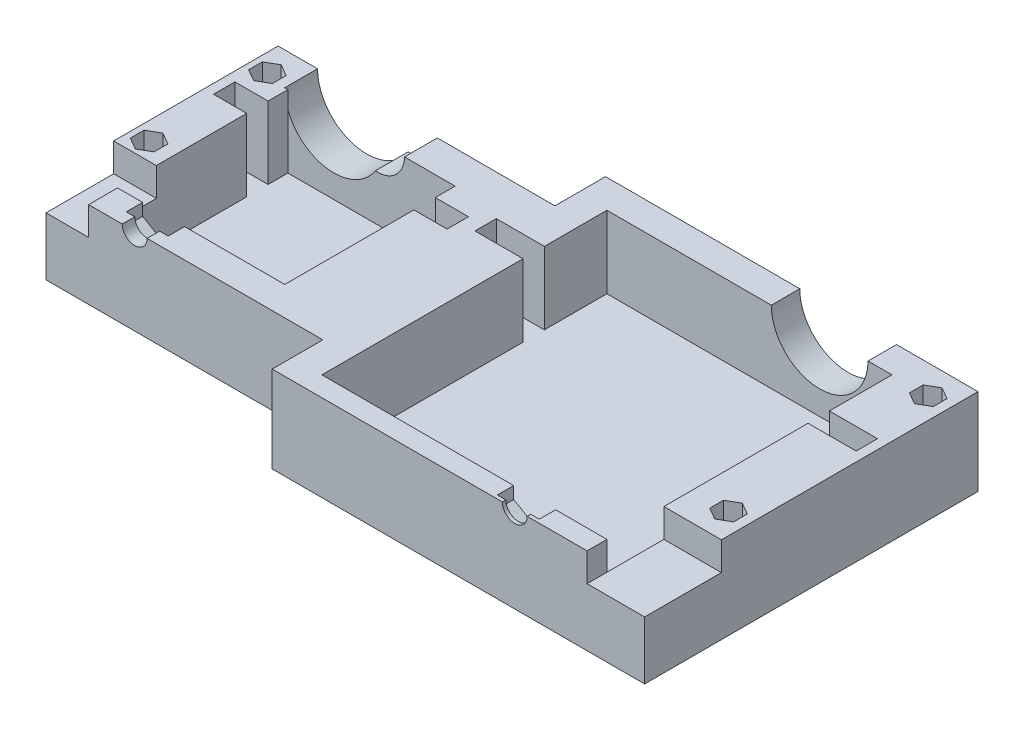
from build123d import *

# Parameters (mm, degrees)
BOSS_EXTRUDE1_DEPTH = 12.1700036
SKETCH2_W           = 8.1000092
SKETCH2_H           = 10.8000038
SKETCH2_W_2         = 6.0000134
SKETCH2_H_2         = 9.5240094
CUT_EXTRUDE1_DEPTH  = 3.999992
CUT_EXTRUDE2_DEPTH  = 10.1700076
CUT_EXTRUDE3_DEPTH  = 4.0060118
CUT_EXTRUDE4_DEPTH  = 4.6199806
CUT_EXTRUDE5_DEPTH  = 5.2500022
CUT_EXTRUDE6_REACH  = 83.189
SKETCH7_R           = 1.7499965
CUT_EXTRUDE7_DEPTH  = 2.2999954
CUT_EXTRUDE8_DEPTH  = 2.2999954
SKETCH10_R          = 1.2499975
CUT_EXTRUDE9_DEPTH  = 71.298530747


with BuildPart() as part:
    # Sketch1 → Boss-Extrude1 (new body)
    with BuildSketch(Plane(origin=(0, 0, 0), x_dir=(1, 0, 0), z_dir=(0, 1, 0))):
        Polygon((-26.1999984, 16.3249991), (-26.1999984, 23.4500039), (26.1999984, 23.4500039), (26.1999984, -23.4500039), (-26.1999984, -23.4500039), (-26.1999984, -16.3249991), (-65.1450056, -16.3249991), (-65.1450056, 16.3249991), align=None)
    extrude(amount=BOSS_EXTRUDE1_DEPTH)

    # Sketch2 → Cut-Extrude1 (cut)
    with BuildSketch(Plane(origin=(0, 12.1700036, 0), x_dir=(1, 0, 0), z_dir=(0, 1, 0))):
        with Locations((22.1499938, -18.050002)):
            Rectangle(SKETCH2_W, SKETCH2_H)
        with Locations((-62.1449989, -11.5629944)):
            Rectangle(SKETCH2_W_2, SKETCH2_H_2)
    extrude(amount=-CUT_EXTRUDE1_DEPTH, mode=Mode.SUBTRACT)

    # Sketch3 → Cut-Extrude2 (cut)
    with BuildSketch(Plane(origin=(0, 12.1700036, 0), x_dir=(1, 0, 0), z_dir=(0, 1, 0))):
        Polygon((-59.1449922, -12.2549793), (-35.6249986, -12.2549793), (-35.6249986, 5.9090179), (-30.9599838, 5.9090179), (-30.9599838, 8.9190195), (-35.6249986, 8.9190195), (-35.6249986, 11.7050185), (-59.1449922, 11.7050185), (-59.1449922, 8.9190195), (-63.810007, 8.9190195), (-63.810007, 5.9090179), (-59.1449922, 5.9090179), align=None)
        Polygon((18.0999892, -20.6560039), (-22.0000068, -20.6560039), (-22.0000068, 7.6439903), (-28.7650174, 7.6439903), (-28.7650174, 10.6439843), (-22.0000068, 10.6439843), (-22.0000068, 19.4439921), (18.0999892, 19.4439921), (18.0999892, 10.6439843), (24.8649998, 10.6439843), (24.8649998, 7.6439903), (18.0999892, 7.6439903), align=None)
    extrude(amount=-CUT_EXTRUDE2_DEPTH, mode=Mode.SUBTRACT)

    # Sketch4 → Cut-Extrude3 (cut)
    with BuildSketch(Plane(origin=(0, 0, -23.4500039), x_dir=(-1, 0, 0), z_dir=(0, 0, -1))):
        with BuildLine():
            Line((-1.1299952, 12.1700036), (-14.7299934, 12.1700036))
            ThreePointArc((-14.7299934, 12.1700036), (-7.9299943, 5.3700045), (-1.1299952, 12.1700036))
        make_face()
    extrude(amount=-CUT_EXTRUDE3_DEPTH, mode=Mode.SUBTRACT)

    # Sketch5 → Cut-Extrude4 (cut)
    with BuildSketch(Plane(origin=(0, 0, -16.3249991), x_dir=(-1, 0, 0), z_dir=(0, 0, -1))):
        with BuildLine():
            ThreePointArc((46.838108, 8.4362036), (54.615256842, 5.524304205), (59.595004, 12.1700036))
            Line((59.595004, 12.1700036), (46.838108, 12.1700036))
            Line((46.838108, 12.1700036), (42.7449996, 12.1700036))
            ThreePointArc((42.7449996, 12.1700036), (43.96774198, 9.400015303), (46.838108, 8.4362036))
        make_face()
    extrude(amount=-CUT_EXTRUDE4_DEPTH, mode=Mode.SUBTRACT)

    # Sketch6 → Cut-Extrude5 (cut)
    with BuildSketch(Plane(origin=(0, 12.1700036, 0), x_dir=(1, 0, 0), z_dir=(0, 1, 0))):
        Polygon((-62.6450106, 14.2591155), (-64.320008607, 13.29205495), (-64.320008607, 11.35793385), (-62.6450106, 10.3908733), (-60.970012593, 11.35793385), (-60.970012593, 13.29205495), align=None)
        Polygon((-62.6450106, -2.3908893), (-64.320008607, -3.35794985), (-64.320008607, -5.29207095), (-62.6450106, -6.2591315), (-60.970012593, -5.29207095), (-60.970012593, -3.35794985), align=None)
        Polygon((23.2000044, 21.3841203), (21.525006393, 20.41705975), (21.525006393, 18.48293865), (23.2000044, 17.5158781), (24.875002407, 18.48293865), (24.875002407, 20.41705975), align=None)
        Polygon((23.2000044, -6.7158743), (21.525006393, -7.68293485), (21.525006393, -9.61705595), (23.2000044, -10.5841165), (24.875002407, -9.61705595), (24.875002407, -7.68293485), align=None)
    extrude(amount=-CUT_EXTRUDE5_DEPTH, mode=Mode.SUBTRACT)

    # Cut-Extrude6: up to this face of the body (flat: up to its plane)
    cut_extrude6_end = Plane(part.part.faces().sort_by_distance((-47.3849954, 7.0849998, 12.2549793))[0])
    # Sketch7 → Cut-Extrude6 (cut, up to the picked face)
    with BuildSketch(Plane.XY.offset(23.4500039), mode=Mode.PRIVATE) as cut_extrude6_sk1:
        with Locations((-52.6700115, 12.1700036)):
            Circle(SKETCH7_R)
    cut_extrude6_tool1 = split(extrude(cut_extrude6_sk1.sketch, amount=-CUT_EXTRUDE6_REACH, mode=Mode.PRIVATE), bisect_by=cut_extrude6_end, keep=Keep.BOTH, mode=Mode.PRIVATE)
    # Sketch7 → Cut-Extrude6 (cut, up to the picked face)
    with BuildSketch(Plane.XY.offset(23.4500039), mode=Mode.PRIVATE) as cut_extrude6_sk2:
        with Locations((7.9299943, 12.1700036)):
            Circle(SKETCH7_R)
    cut_extrude6_tool2 = split(extrude(cut_extrude6_sk2.sketch, amount=-CUT_EXTRUDE6_REACH, mode=Mode.PRIVATE), bisect_by=cut_extrude6_end, keep=Keep.BOTH, mode=Mode.PRIVATE)
    add(cut_extrude6_tool1.solids().sort_by(Axis((-52.670012, 12.170004, 23.450004), (0, 0, -1)))[0], mode=Mode.SUBTRACT)
    add(cut_extrude6_tool2.solids().sort_by(Axis((7.929994, 12.170004, 23.450004), (0, 0, -1)))[0], mode=Mode.SUBTRACT)

    # Sketch8 → Cut-Extrude7 (cut)
    with BuildSketch(Plane(origin=(0, 0, 20.6560039), x_dir=(-1, 0, 0), z_dir=(0, 0, -1))):
        Polygon((-10.8799884, 12.1700036), (-10.8799884, 10.466832), (-7.9299943, 8.763634463), (-4.9800002, 10.466832), (-4.9800002, 12.1700036), align=None)
    extrude(amount=-CUT_EXTRUDE7_DEPTH, mode=Mode.SUBTRACT)

    # Sketch9 → Cut-Extrude8 (cut)
    with BuildSketch(Plane(origin=(0, 0, 12.2549793), x_dir=(-1, 0, 0), z_dir=(0, 0, -1))):
        Polygon((49.7200174, 12.1700036), (49.7200174, 10.466832), (52.6700115, 8.763634463), (55.6200056, 10.466832), (55.6200056, 12.1700036), align=None)
    extrude(amount=-CUT_EXTRUDE8_DEPTH, mode=Mode.SUBTRACT)

    # Sketch10 → Cut-Extrude9 (cut, through all)
    with BuildSketch(Plane(origin=(0, 12.1700036, 0), x_dir=(1, 0, 0), z_dir=(0, 1, 0))):
        with Locations(Location((-62.6450106, 12.3249944, 0), (0, 0, 270))):
            Circle(SKETCH10_R)
        with Locations(Location((-62.6450106, -4.3250104, 0), (0, 0, 270))):
            Circle(SKETCH10_R)
        with Locations(Location((23.2000044, -8.6499954, 0), (0, 0, 270))):
            Circle(SKETCH10_R)
        with Locations(Location((23.2000044, 19.4499992, 0), (0, 0, 270))):
            Circle(SKETCH10_R)
    extrude(amount=-CUT_EXTRUDE9_DEPTH, mode=Mode.SUBTRACT)


solid = part.part
